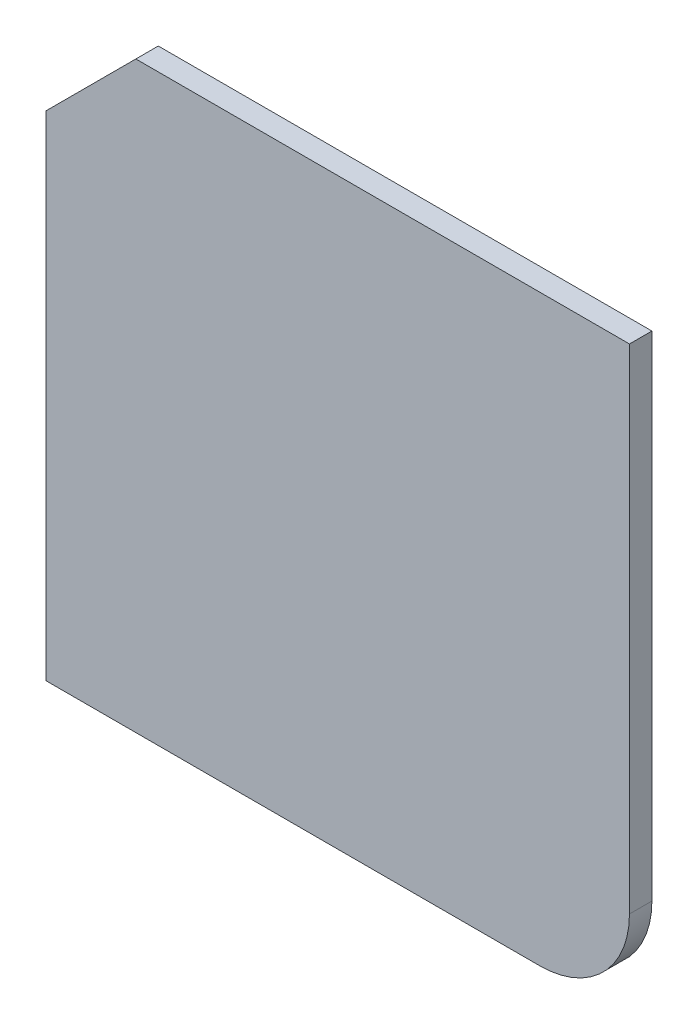
from build123d import *

# Parameters (mm, degrees)
SKETCH1_W           = 130
SKETCH1_H           = 130
BOSS_EXTRUDE1_DEPTH = 5
FILLET1_R           = 20
CHAMFER1_SIZE       = 20


with BuildPart() as part:
    # Sketch1 → Boss-Extrude1 (new body)
    with BuildSketch(Plane.XY):
        with Locations((65, 65)):
            Rectangle(SKETCH1_W, SKETCH1_H)
    extrude(amount=BOSS_EXTRUDE1_DEPTH)

    # Fillet1
    fillet1_edges = [part.edges().sort_by_distance(p)[0] for p in [
        (130, 0, 2.5),
    ]]
    fillet(fillet1_edges, radius=FILLET1_R)

    # Chamfer1
    chamfer1_edges = [part.edges().sort_by_distance(p)[0] for p in [
        (0, 130, 2.5),
    ]]
    chamfer(chamfer1_edges, length=CHAMFER1_SIZE)


solid = part.part
